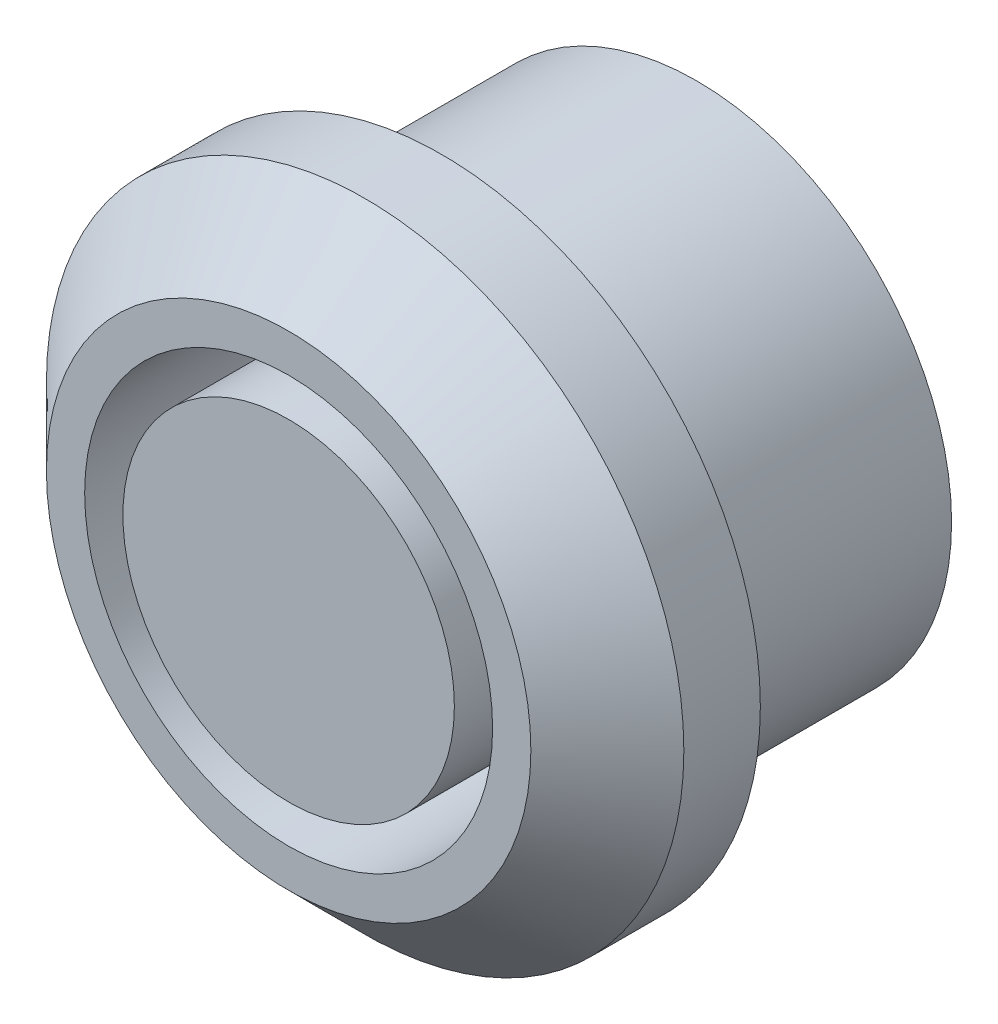
from build123d import *

# Parameters (mm, degrees)
ESQUISSE1_R             = 12.5
BASE_EXTRUSION_DEPTH    = 6
CHANFREIN1_SIZE         = 3
ESQUISSE2_R             = 10
BOSS_EXTRU_1_DEPTH      = 10
ESQUISSE3_R             = 8
ENL_V_MAT_EXTRU_1_DEPTH = 10
ESQUISSE4_R             = 6.5
BOSS_EXTRU_2_DEPTH      = 10


with BuildPart() as part:
    # Esquisse1 → Base-Extrusion (new body)
    with BuildSketch(Plane.XY):
        Circle(ESQUISSE1_R)
    extrude(amount=BASE_EXTRUSION_DEPTH)

    # Chanfrein1
    chanfrein1_edges = [part.edges().sort_by_distance(p)[0] for p in [
        (-12.5, 0, 6),
    ]]
    chamfer(chanfrein1_edges, length=CHANFREIN1_SIZE)

    # Esquisse2 → Boss.-Extru.1 (add)
    with BuildSketch(Plane(origin=(0, 0, 0), x_dir=(-1, 0, 0), z_dir=(0, 0, -1))):
        with Locations(Location((0, 0, 0), (0, 0, 180))):
            Circle(ESQUISSE2_R)
    extrude(amount=BOSS_EXTRU_1_DEPTH)

    # Esquisse3 → Enlèv. mat.-Extru.1 (cut)
    with BuildSketch(Plane.XY.offset(6)):
        Circle(ESQUISSE3_R)
    extrude(amount=-ENL_V_MAT_EXTRU_1_DEPTH, mode=Mode.SUBTRACT)

    # Esquisse4 → Boss.-Extru.2 (add)
    with BuildSketch(Plane.XY.offset(-4)):
        Circle(ESQUISSE4_R)
    extrude(amount=BOSS_EXTRU_2_DEPTH)


solid = part.part
